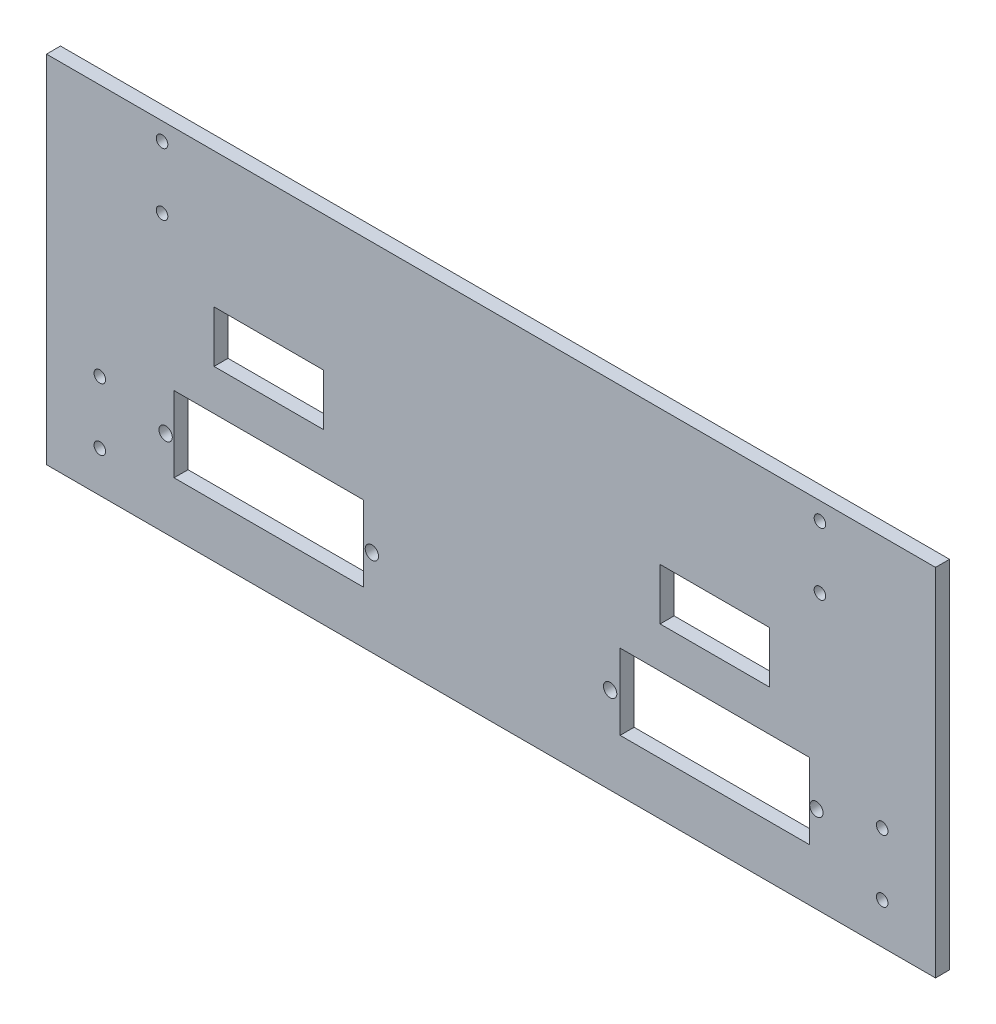
from build123d import *

# Parameters (mm, degrees)
SKETCH1_W           = 254
SKETCH1_H           = 101.6
SKETCH1_R           = 1.905
SKETCH1_R_2         = 1.651
SKETCH1_W_2         = 31.242
SKETCH1_H_2         = 14.732
BOSS_EXTRUDE1_DEPTH = 4


with BuildPart() as part:
    # Sketch1 → Boss-Extrude1 (new body)
    with BuildSketch(Plane.XY):
        with Locations((127, 50.8)):
            Rectangle(SKETCH1_W, SKETCH1_H)
        with Locations((34.036, 24.765)):
            Circle(SKETCH1_R, mode=Mode.SUBTRACT)
        with Locations((92.964, 24.765)):
            Circle(SKETCH1_R, mode=Mode.SUBTRACT)
        with Locations((161.036, 24.765)):
            Circle(SKETCH1_R, mode=Mode.SUBTRACT)
        with Locations((219.964, 24.765)):
            Circle(SKETCH1_R, mode=Mode.SUBTRACT)
        with Locations((33.02, 78.74)):
            Circle(SKETCH1_R_2, mode=Mode.SUBTRACT)
        with Locations((33.02, 96.52)):
            Circle(SKETCH1_R_2, mode=Mode.SUBTRACT)
        with Locations((220.98, 78.74)):
            Circle(SKETCH1_R_2, mode=Mode.SUBTRACT)
        with Locations((220.98, 96.52)):
            Circle(SKETCH1_R_2, mode=Mode.SUBTRACT)
        with Locations((15.24, 11.684)):
            Circle(SKETCH1_R_2, mode=Mode.SUBTRACT)
        with Locations((15.24, 29.464)):
            Circle(SKETCH1_R_2, mode=Mode.SUBTRACT)
        with Locations((238.76, 29.464)):
            Circle(SKETCH1_R_2, mode=Mode.SUBTRACT)
        with Locations((238.76, 11.684)):
            Circle(SKETCH1_R_2, mode=Mode.SUBTRACT)
        Polygon((63.5, 14.986), (90.551, 14.986), (90.551, 36.576), (36.449, 36.576), (36.449, 14.986), align=None, mode=Mode.SUBTRACT)
        Polygon((190.5, 14.98050389), (217.992332172, 14.98050389), (217.992332172, 36.57050389), (163.890331935, 36.57050389), (163.890331935, 14.98050389), align=None, mode=Mode.SUBTRACT)
        with Locations((63.5, 55.626)):
            Rectangle(SKETCH1_W_2, SKETCH1_H_2, mode=Mode.SUBTRACT)
        with Locations((190.941332053, 55.626)):
            Rectangle(SKETCH1_W_2, SKETCH1_H_2, mode=Mode.SUBTRACT)
    extrude(amount=BOSS_EXTRUDE1_DEPTH)


solid = part.part
